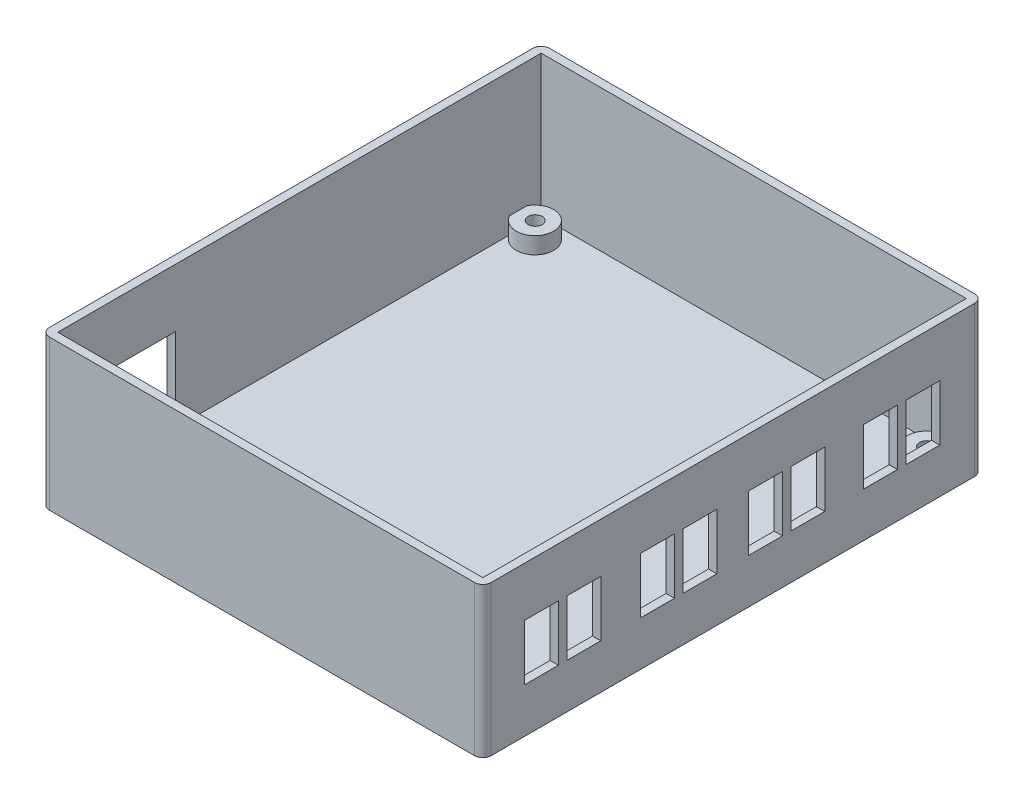
from build123d import *

# Parameters (mm, degrees)
SKIZZE1_W                                    = 106
SKIZZE1_H                                    = 120
AUFSATZ_LINEAR_AUSTRAGEN1_DEPTH              = 36
WANDUNG1_T                                   = -2
SKIZZE2_R                                    = 4.5
AUFSATZ_LINEAR_AUSTRAGEN2_DEPTH              = 4
VERRUNDUNG1_R                                = 2
STIRNSENKUNG_F_R_M3_ZYLINDERSCHRAUBE_2_COUNT = 2
STIRNSENKUNG_F_R_M3_ZYLINDERSCHRAUBE_2_PITCH = 140.889047126
STIRNSENKUNG_F_R_M3_ZYLINDERSCHRAUBE_3_COUNT = 2
STIRNSENKUNG_F_R_M3_ZYLINDERSCHRAUBE_3_PITCH = 105
STIRNSENKUNG_F_R_M3_ZYLINDERSCHRAUBE_4_COUNT = 2
STIRNSENKUNG_F_R_M3_ZYLINDERSCHRAUBE_4_PITCH = 93.94
SKIZZE7_W                                    = 17
SKIZZE7_H                                    = 14.6
SCHNITT_LINEAR_AUSTRAGEN1_DEPTH              = 10
SKIZZE8_W                                    = 8.16
SKIZZE8_H                                    = 13.4
SCHNITT_LINEAR_AUSTRAGEN2_DEPTH              = 10
LINEARES_MUSTER2_COUNT                       = 2
LINEARES_MUSTER2_PITCH                       = 27.85
LINEARES_MUSTER3_COUNT                       = 2
LINEARES_MUSTER3_PITCH                       = 53.76
LINEARES_MUSTER4_COUNT                       = 2
LINEARES_MUSTER4_PITCH                       = 81.35
SKIZZE10_W                                   = 5
SKIZZE10_H                                   = 3
SCHNITT_LINEAR_AUSTRAGEN3_DEPTH              = 3


with BuildPart() as part:
    # Skizze1 → Aufsatz-Linear austragen1 (new body)
    with BuildSketch(Plane(origin=(0, 0, 0), x_dir=(1, 0, 0), z_dir=(0, 1, 0))):
        with Locations((53, 60)):
            Rectangle(SKIZZE1_W, SKIZZE1_H)
    extrude(amount=AUFSATZ_LINEAR_AUSTRAGEN1_DEPTH)

    # Wandung1
    wandung1_openings = [part.faces().sort_by_distance(p)[0] for p in [
        (53, 36, -60),
    ]]
    offset(amount=WANDUNG1_T, openings=wandung1_openings, kind=Kind.INTERSECTION)

    # Skizze2 → Aufsatz-Linear austragen2 (add)
    with BuildSketch(Plane(origin=(0, 2, 0), x_dir=(1, 0, 0), z_dir=(0, 1, 0))):
        with Locations((6, 7.5)):
            Circle(SKIZZE2_R)
        with Locations((99.94, 7.5)):
            Circle(SKIZZE2_R)
        with Locations((99.94, 112.5)):
            Circle(SKIZZE2_R)
        with Locations((6, 112.5)):
            Circle(SKIZZE2_R)
    extrude(amount=AUFSATZ_LINEAR_AUSTRAGEN2_DEPTH)

    # Verrundung1
    verrundung1_edges = [part.edges().sort_by_distance(p)[0] for p in [
        (0, 18, -120),
        (106, 18, -120),
        (106, 18, 0),
        (0, 18, 0),
    ]]
    fillet(verrundung1_edges, radius=VERRUNDUNG1_R)

    # Skizze6 → Stirnsenkung für M3 Zylinderschraube mit Innensechskant1 (revolve, cut)
    with BuildSketch(Plane(origin=(100, 0, -7.5), x_dir=(0, 0, -1), z_dir=(1, 0, 0))):
        Polygon((0, 0), (0, 15.021463052), (1.7, 14), (1.7, 3.4), (3.25, 3.4), (3.25, 0.025), (3.275, 0), align=None)
    stirnsenkung_f_r_m3_zylinderschraube_mit = revolve(axis=Axis((100, -6.35, -7.5), (0, 1, 0)), mode=Mode.SUBTRACT)

    # Stirnsenkung f_r M3 Zylinderschraube 2: Stirnsenkung für M3 Zylinderschraube mit Innensechskant1 ×2
    with Locations(*[Vector(-0.6667658126480086, 0, -0.7452673017675208) * (i * STIRNSENKUNG_F_R_M3_ZYLINDERSCHRAUBE_2_PITCH) for i in range(1, STIRNSENKUNG_F_R_M3_ZYLINDERSCHRAUBE_2_COUNT)]):
        add(stirnsenkung_f_r_m3_zylinderschraube_mit, mode=Mode.SUBTRACT)

    # Stirnsenkung f_r M3 Zylinderschraube 3: Stirnsenkung für M3 Zylinderschraube mit Innensechskant1 ×2
    with Locations(*[(0, 0, -i * STIRNSENKUNG_F_R_M3_ZYLINDERSCHRAUBE_3_PITCH) for i in range(1, STIRNSENKUNG_F_R_M3_ZYLINDERSCHRAUBE_3_COUNT)]):
        add(stirnsenkung_f_r_m3_zylinderschraube_mit, mode=Mode.SUBTRACT)

    # Stirnsenkung f_r M3 Zylinderschraube 4: Stirnsenkung für M3 Zylinderschraube mit Innensechskant1 ×2
    with Locations(*[(-i * STIRNSENKUNG_F_R_M3_ZYLINDERSCHRAUBE_4_PITCH, 0, 0) for i in range(1, STIRNSENKUNG_F_R_M3_ZYLINDERSCHRAUBE_4_COUNT)]):
        add(stirnsenkung_f_r_m3_zylinderschraube_mit, mode=Mode.SUBTRACT)

    # Skizze7 → Schnitt-Linear austragen1 (cut)
    with BuildSketch(Plane.ZY):
        with Locations((-21.75, 14.72)):
            Rectangle(SKIZZE7_W, SKIZZE7_H)
    extrude(amount=-SCHNITT_LINEAR_AUSTRAGEN1_DEPTH, mode=Mode.SUBTRACT)

    # Skizze8 → Schnitt-Linear austragen2 (cut)
    with BuildSketch(Plane(origin=(106, 0, 0), x_dir=(0, 0, -1), z_dir=(1, 0, 0))):
        with Locations((14.06, 17.42)):
            Rectangle(SKIZZE8_W, SKIZZE8_H)
        with Locations((24.22, 17.42)):
            Rectangle(SKIZZE8_W, SKIZZE8_H)
    schnitt_linear_austragen2 = extrude(amount=-SCHNITT_LINEAR_AUSTRAGEN2_DEPTH, mode=Mode.SUBTRACT)

    # Lineares Muster2: Schnitt-Linear austragen2 ×2
    with Locations(*[(0, 0, -i * LINEARES_MUSTER2_PITCH) for i in range(1, LINEARES_MUSTER2_COUNT)]):
        add(schnitt_linear_austragen2, mode=Mode.SUBTRACT)

    # Lineares Muster3: Schnitt-Linear austragen2 ×2
    with Locations(*[(0, 0, -i * LINEARES_MUSTER3_PITCH) for i in range(1, LINEARES_MUSTER3_COUNT)]):
        add(schnitt_linear_austragen2, mode=Mode.SUBTRACT)

    # Lineares Muster4: Schnitt-Linear austragen2 ×2
    with Locations(*[(0, 0, -i * LINEARES_MUSTER4_PITCH) for i in range(1, LINEARES_MUSTER4_COUNT)]):
        add(schnitt_linear_austragen2, mode=Mode.SUBTRACT)

    # Skizze10 → Schnitt-Linear austragen3 (cut)
    with BuildSketch(Plane.ZY):
        with Locations((-21.75, 5.92)):
            Rectangle(SKIZZE10_W, SKIZZE10_H)
    extrude(amount=-SCHNITT_LINEAR_AUSTRAGEN3_DEPTH, mode=Mode.SUBTRACT)


solid = part.part
